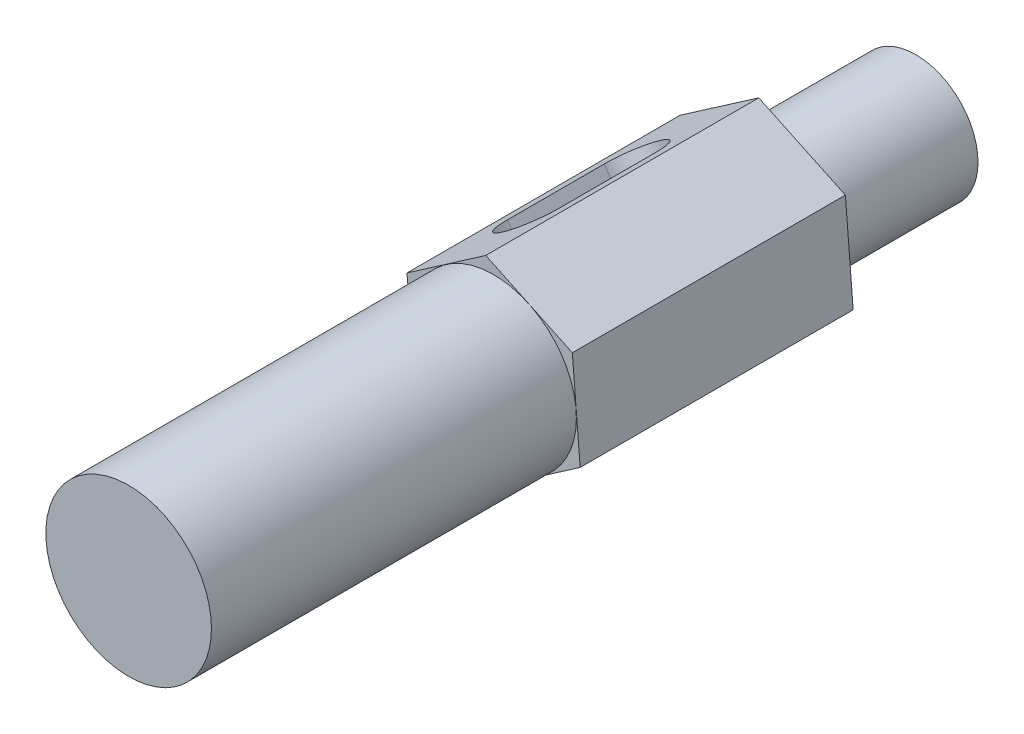
from build123d import *

# Parameters (mm, degrees)
SKETCH1_R           = 2.7305
BOSS_EXTRUDE1_DEPTH = 20.9042
SKETCH2_R           = 6.33984
BOSS_EXTRUDE2_DEPTH = 27.94
BOSS_EXTRUDE3_START = 11.43
SKETCH3_R           = 4.75361
SKETCH3_R_2         = 2.7305
BOSS_EXTRUDE3_DEPTH = 11.43
CUT_EXTRUDE1_REACH  = 53.455


with BuildPart() as part:
    # Sketch1 → Boss-Extrude1 (new body)
    with BuildSketch(Plane.XY):
        Polygon((6.029568492, 4.172246054), (-0.598486828, 7.307882515), (-6.62805532, 3.13563646), (-6.029568492, -4.172246054), (0.598486828, -7.307882515), (6.62805532, -3.13563646), align=None)
        Circle(SKETCH1_R, mode=Mode.SUBTRACT)
    extrude(amount=BOSS_EXTRUDE1_DEPTH)

    # Sketch2 → Boss-Extrude2 (add)
    with BuildSketch(Plane.XY.offset(20.9042)):
        Circle(SKETCH2_R)
    extrude(amount=BOSS_EXTRUDE2_DEPTH)

    # Sketch3 → Boss-Extrude3 (add)
    with BuildSketch(Plane(origin=(0, 0, 0), x_dir=(-1, 0, 0), z_dir=(0, 0, -1)).offset(BOSS_EXTRUDE3_START)):
        with Locations(Location((0, 0, 0), (0, 0, 180))):
            Circle(SKETCH3_R)
        Circle(SKETCH3_R_2, mode=Mode.SUBTRACT)
    extrude(amount=-BOSS_EXTRUDE3_DEPTH)

    # Cut-Extrude1: up to this face of the body (flat: up to its plane)
    cut_extrude1_end = Plane(part.part.faces().sort_by_distance((3.613271074, -5.221759488, 10.4521))[0])
    # Sketch4 → Cut-Extrude1 (cut, up to the picked face)
    with BuildSketch(Plane(origin=(-3.613271074, 5.221759488, 0), x_dir=(0.8223243287496799, 0.5690190667687582, 0), z_dir=(-0.5690190667687582, 0.82232432874968, 0)), mode=Mode.PRIVATE) as cut_extrude1_sk1:
        with BuildLine():
            Line((-2.3876, -14.2748), (-2.3876, -6.858))
            ThreePointArc((-2.3876, -6.858), (0, -4.4704), (2.3876, -6.858))
            Line((2.3876, -6.858), (2.3876, -14.2748))
            ThreePointArc((2.3876, -14.2748), (0, -16.6624), (-2.3876, -14.2748))
        make_face()
    cut_extrude1_tool1 = split(extrude(cut_extrude1_sk1.sketch, amount=-CUT_EXTRUDE1_REACH, mode=Mode.PRIVATE), bisect_by=cut_extrude1_end, keep=Keep.BOTH, mode=Mode.PRIVATE)
    add(cut_extrude1_tool1.solids().sort_by(Axis((-3.613271, 5.221759, 10.5664), (0.5690190667687582, -0.82232432874968, 0)))[0], mode=Mode.SUBTRACT)


solid = part.part
